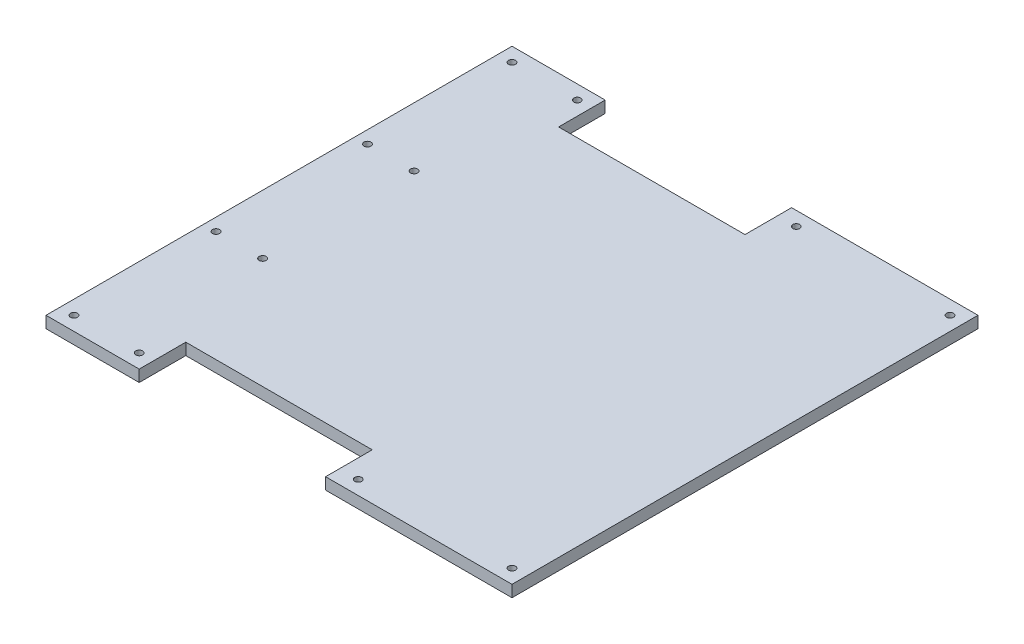
from build123d import *

# Parameters (mm, degrees)
BOSS_EXTRUDE1_DEPTH = 5
SKETCH2_R           = 1.5
CUT_EXTRUDE1_DEPTH  = 20
SKETCH3_R           = 1.5
CUT_EXTRUDE2_DEPTH  = 5


with BuildPart() as part:
    # Sketch1 → Boss-Extrude1 (new body)
    with BuildSketch(Plane(origin=(0, 0, 0), x_dir=(1, 0, 0), z_dir=(0, 1, 0))):
        Polygon((67.547169811, 149.902137597), (67.547169811, 129.902137597), (147.547169811, 129.902137597), (147.547169811, 149.902137597), (227.547169811, 149.902137597), (227.547169811, -50.097862403), (147.547169811, -50.097862403), (147.547169811, -30.097862403), (67.547169811, -30.097862403), (67.547169811, -50.097862403), (27.547169811, -50.097862403), (27.547169811, 149.902137597), align=None)
    extrude(amount=BOSS_EXTRUDE1_DEPTH)

    # Sketch2 → Cut-Extrude1 (cut)
    with BuildSketch(Plane(origin=(0, 5, 0), x_dir=(1, 0, 0), z_dir=(0, 1, 0))):
        with Locations((33.547169811, 143.902137597)):
            Circle(SKETCH2_R)
        with Locations((61.547169811, 143.902137597)):
            Circle(SKETCH2_R)
        with Locations((33.547169811, -44.097862403)):
            Circle(SKETCH2_R)
        with Locations((61.547169811, -44.097862403)):
            Circle(SKETCH2_R)
        with Locations((155.547169811, -44.097862403)):
            Circle(SKETCH2_R)
        with Locations((221.547169811, -44.097862403)):
            Circle(SKETCH2_R)
        with Locations((155.547169811, 143.902137597)):
            Circle(SKETCH2_R)
        with Locations((221.547169811, 143.902137597)):
            Circle(SKETCH2_R)
    extrude(amount=-CUT_EXTRUDE1_DEPTH, mode=Mode.SUBTRACT)

    # Sketch3 → Cut-Extrude2 (cut)
    with BuildSketch(Plane(origin=(0, 5, 0), x_dir=(1, 0, 0), z_dir=(0, 1, 0))):
        with Locations((32.908431657, 82.511625863)):
            Circle(SKETCH3_R)
        with Locations((32.908431657, 17.511625863)):
            Circle(SKETCH3_R)
        with Locations((52.908431657, 17.511625863)):
            Circle(SKETCH3_R)
        with Locations((52.908431657, 82.511625863)):
            Circle(SKETCH3_R)
    extrude(amount=-CUT_EXTRUDE2_DEPTH, mode=Mode.SUBTRACT)


solid = part.part
